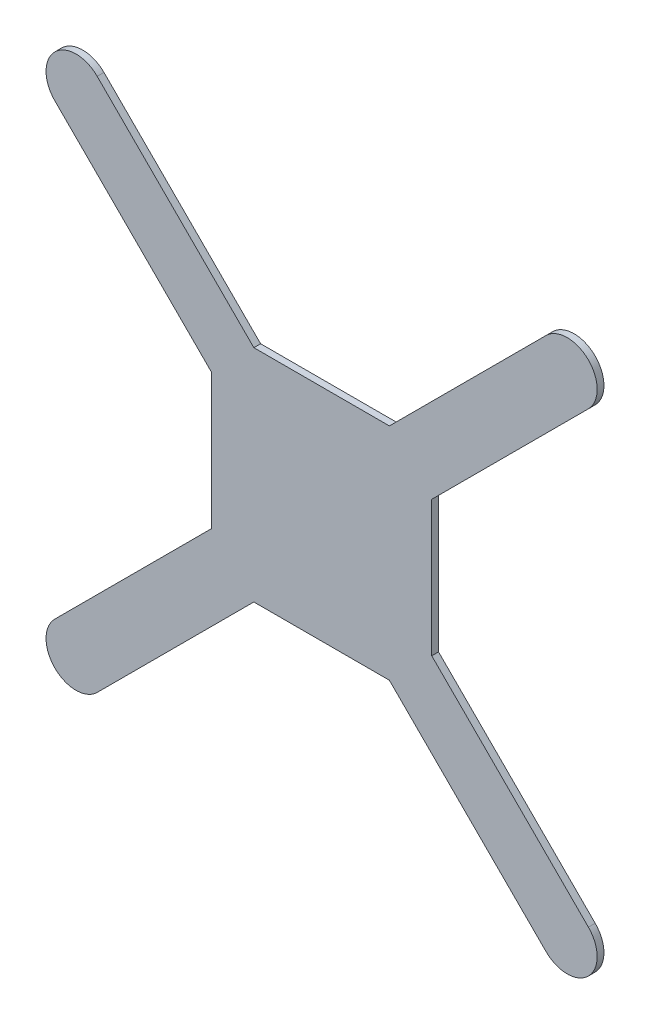
from build123d import *

# Parameters (mm, degrees)
EXTRUDE_1_DEPTH = 4


with BuildPart() as part:
    # 草图1 → 凸台-拉伸1 (new body)
    with BuildSketch(Plane.XY):
        with BuildLine():
            ThreePointArc((-132.456890143, -157.456890143), (-157.456890143, -157.456890143), (-157.456890143, -132.456890143))
            Line((-157.456890143, -132.456890143), (-65, -40))
            Line((-65, -40), (-40, -65))
            Line((-40, -65), (-132.456890143, -157.456890143))
        make_face()
        with BuildLine():
            Line((-40, 65), (-132.456890143, 157.456890143))
            ThreePointArc((-132.456890143, 157.456890143), (-157.456890143, 157.456890143), (-157.456890143, 132.456890143))
            Line((-157.456890143, 132.456890143), (-65, 40))
            Line((-65, 40), (-40, 65))
        make_face()
        Polygon((-65, 40), (-65, -40), (-40, -65), (40, -65), (65, -40), (65, 40), (40, 65), (-40, 65), align=None)
        with BuildLine():
            Line((40, -65), (132.456890143, -157.456890143))
            ThreePointArc((132.456890143, -157.456890143), (157.456890143, -157.456890143), (157.456890143, -132.456890143))
            Line((157.456890143, -132.456890143), (65, -40))
            Line((65, -40), (40, -65))
        make_face()
        with BuildLine():
            ThreePointArc((132.456890143, 157.456890143), (157.456890143, 157.456890143), (157.456890143, 132.456890143))
            Line((157.456890143, 132.456890143), (65, 40))
            Line((65, 40), (40, 65))
            Line((40, 65), (132.456890143, 157.456890143))
        make_face()
    extrude(amount=EXTRUDE_1_DEPTH)


solid = part.part
